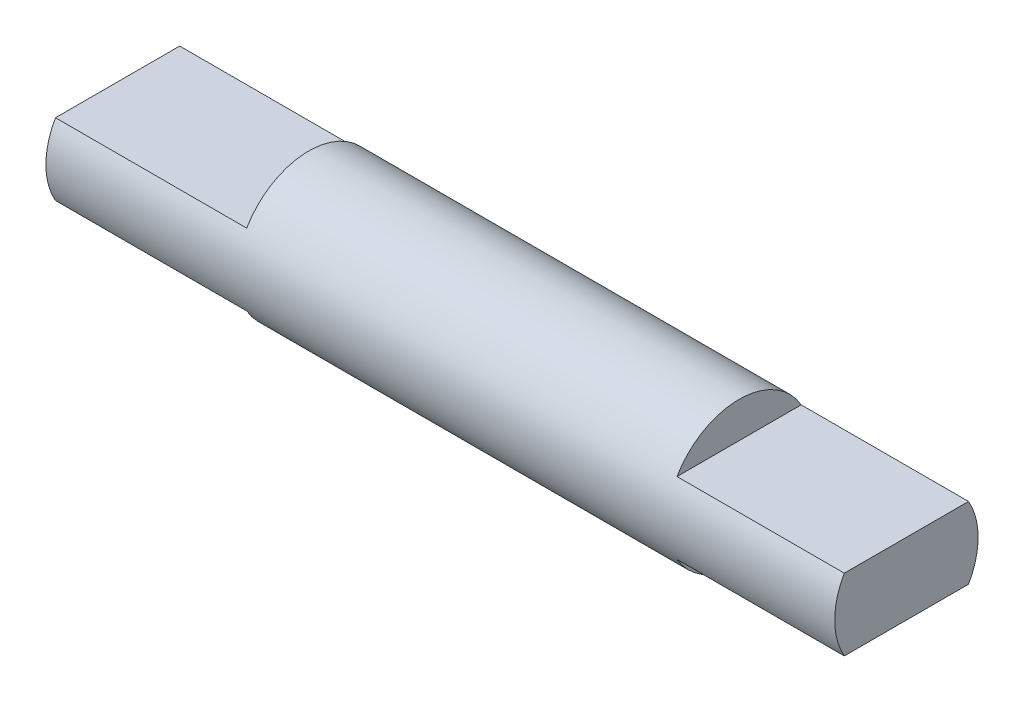
from build123d import *

# Parameters (mm, degrees)
SKETCH1_R           = 3
BOSS_EXTRUDE1_DEPTH = 33
CUT_EXTRUDE1_DEPTH  = 8
CUT_EXTRUDE2_START  = -7
CUT_EXTRUDE2_DEPTH  = 7


with BuildPart() as part:
    # Sketch1 → Boss-Extrude1 (new body)
    with BuildSketch(Plane(origin=(0, 0, 0), x_dir=(0, 0, -1), z_dir=(1, 0, 0))):
        Circle(SKETCH1_R)
    extrude(amount=BOSS_EXTRUDE1_DEPTH)

    # Sketch2 → Cut-Extrude1 (cut)
    with BuildSketch(Plane.ZY):
        with BuildLine():
            Line((-2.598076211, 1.5), (2.598076211, 1.5))
            ThreePointArc((2.598076211, 1.5), (0, 3), (-2.598076211, 1.5))
        make_face()
        with BuildLine():
            Line((-2.598076211, -1.5), (2.598076211, -1.5))
            ThreePointArc((2.598076211, -1.5), (0, -3), (-2.598076211, -1.5))
        make_face()
    extrude(amount=-CUT_EXTRUDE1_DEPTH, mode=Mode.SUBTRACT)

    # Sketch3 → Cut-Extrude2 (cut)
    with BuildSketch(Plane(origin=(33, 0, 0), x_dir=(0, 0, -1), z_dir=(1, 0, 0)).offset(CUT_EXTRUDE2_START)):
        with BuildLine():
            Line((-2.598076211, 1.5), (2.598076211, 1.5))
            ThreePointArc((2.598076211, 1.5), (0, 3), (-2.598076211, 1.5))
        make_face()
        with BuildLine():
            Line((-2.598076211, -1.5), (2.598076211, -1.5))
            ThreePointArc((2.598076211, -1.5), (0, -3), (-2.598076211, -1.5))
        make_face()
    extrude(amount=CUT_EXTRUDE2_DEPTH, mode=Mode.SUBTRACT)


solid = part.part
